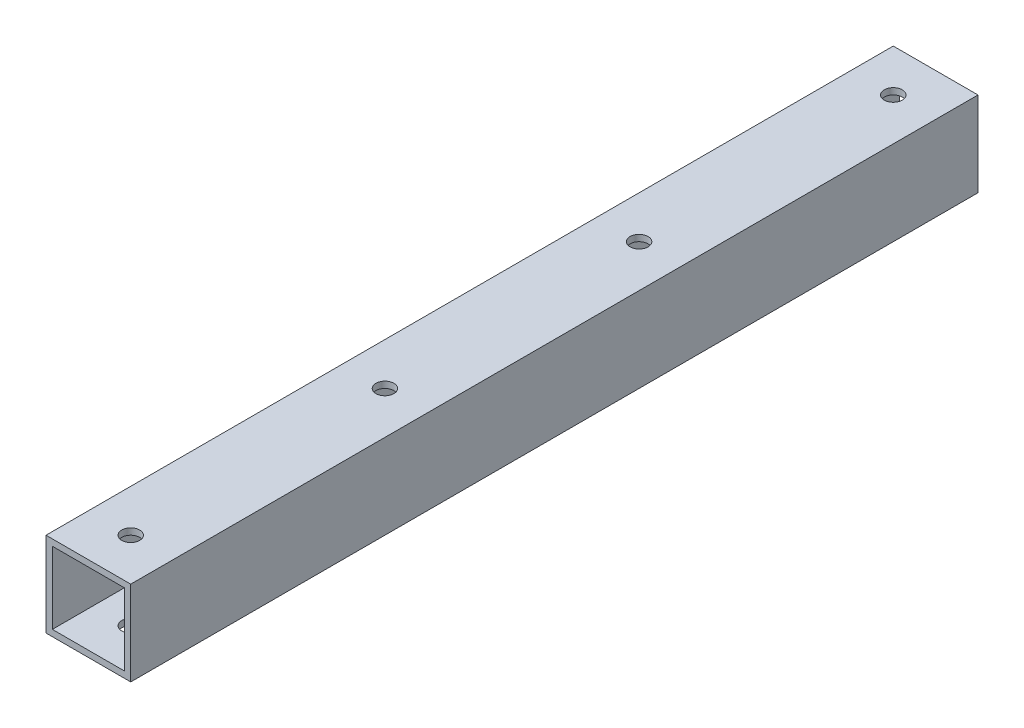
from build123d import *

# Parameters (mm, degrees)
SKETCH1_W           = 20
SKETCH1_H           = 20
SKETCH1_W_2         = 17
SKETCH1_H_2         = 17
BOSS_EXTRUDE1_DEPTH = 200
SKETCH2_R           = 2.125
CUT_EXTRUDE1_DEPTH  = 202.246117975


with BuildPart() as part:
    # Sketch1 → Boss-Extrude1 (new body)
    with BuildSketch(Plane.XY):
        Rectangle(SKETCH1_W, SKETCH1_H)
        Rectangle(SKETCH1_W_2, SKETCH1_H_2, mode=Mode.SUBTRACT)
    extrude(amount=-BOSS_EXTRUDE1_DEPTH)

    # Sketch2 → Cut-Extrude1 (cut, through all)
    with BuildSketch(Plane(origin=(0, 10, 0), x_dir=(1, 0, 0), z_dir=(0, 1, 0))):
        with Locations(Location((0, 10, 0), (0, 0, 270))):
            Circle(SKETCH2_R)
        with Locations(Location((0, 70, 0), (0, 0, 270))):
            Circle(SKETCH2_R)
        with Locations(Location((0, 130, 0), (0, 0, 270))):
            Circle(SKETCH2_R)
        with Locations(Location((0, 190, 0), (0, 0, 270))):
            Circle(SKETCH2_R)
    extrude(amount=-CUT_EXTRUDE1_DEPTH, mode=Mode.SUBTRACT)


solid = part.part
